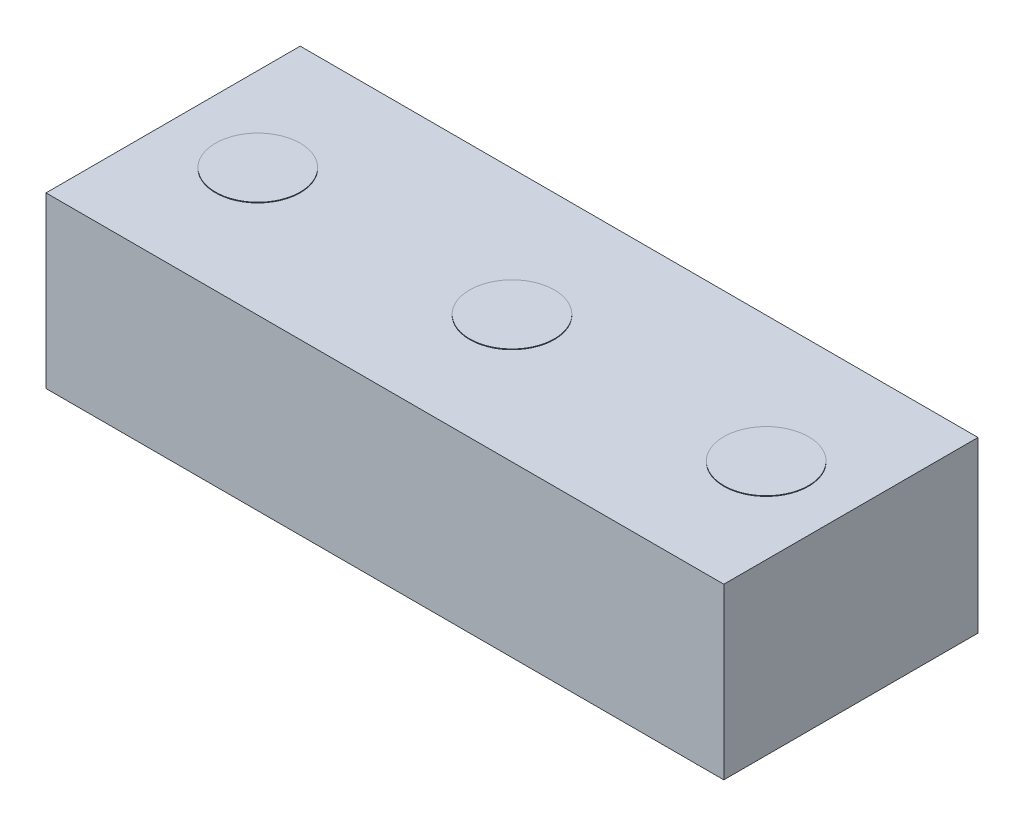
from build123d import *

# Parameters (mm, degrees)
SKETCH_1_W        = 400
SKETCH_1_H        = 150
SKETCH_1_W_2      = 395
SKETCH_1_H_2      = 145
EXTRUDE_1_DEPTH   = 100
SKETCH_2_W        = 400
SKETCH_2_H        = 150
EXTRUDE_1_2_DEPTH = 2.5
SKETCH_3_R        = 25
EXTRUDE_2_DEPTH   = 0.4
EXTRUDE_2_2_DEPTH = 0.4
EXTRUDE_2_3_DEPTH = 0.4


with BuildPart() as part:
    # 草图1 → Extrude 1 (new body)
    with BuildSketch(Plane(origin=(0, 0, 0), x_dir=(1, 0, 0), z_dir=(0, 1, 0))):
        Rectangle(SKETCH_1_W, SKETCH_1_H)
        Rectangle(SKETCH_1_W_2, SKETCH_1_H_2, mode=Mode.SUBTRACT)
    extrude(amount=EXTRUDE_1_DEPTH)

    # 草图2 → Extrude 1 2 (add)
    with BuildSketch(Plane(origin=(0, 100, 0), x_dir=(1, 0, 0), z_dir=(0, 1, 0))):
        Rectangle(SKETCH_2_W, SKETCH_2_H)
    extrude(amount=-EXTRUDE_1_2_DEPTH)


with BuildPart() as body_2:
    # 草图3 → 凸台-拉伸2 (new body)
    with BuildSketch(Plane(origin=(0, 100, 0), x_dir=(1, 0, 0), z_dir=(0, 1, 0))):
        with Locations(Location((0, 0, 0), (0, 0, 270))):
            Circle(SKETCH_3_R)
    extrude(amount=EXTRUDE_2_DEPTH)


with BuildPart() as body_3:
    # 草图3 → Extrude 2 2 (new body)
    with BuildSketch(Plane(origin=(0, 100, 0), x_dir=(1, 0, 0), z_dir=(0, 1, 0))):
        with Locations(Location((150, 0, 0), (0, 0, 270))):
            Circle(SKETCH_3_R)
    extrude(amount=EXTRUDE_2_2_DEPTH)


with BuildPart() as body_4:
    # 草图3 → Extrude 2 3 (new body)
    with BuildSketch(Plane(origin=(0, 100, 0), x_dir=(1, 0, 0), z_dir=(0, 1, 0))):
        with Locations(Location((-150, 0, 0), (0, 0, 90))):
            Circle(SKETCH_3_R)
    extrude(amount=EXTRUDE_2_3_DEPTH)


solid = Compound([part.part, body_2.part, body_3.part, body_4.part])
